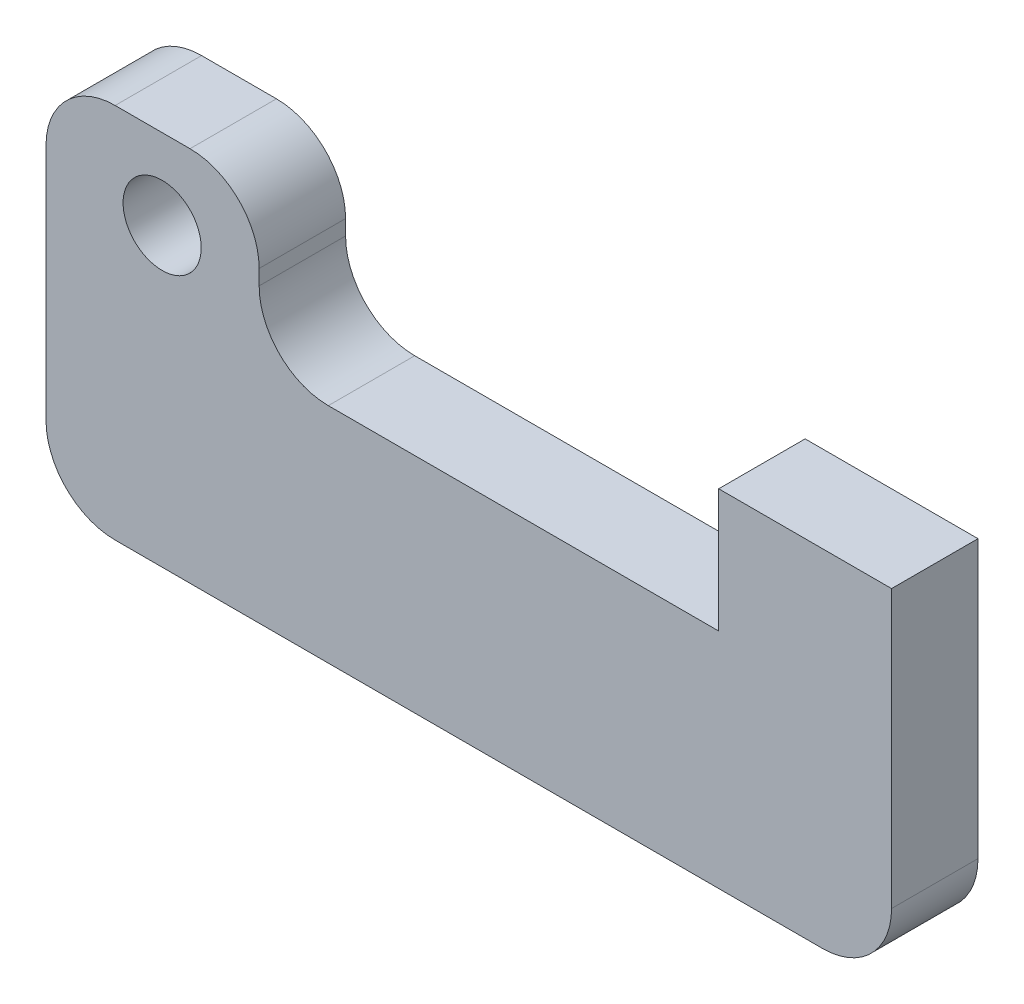
from build123d import *

# Parameters (mm, degrees)
SKETCH1_R           = 2.8702
BOSS_EXTRUDE1_DEPTH = 6.35
FILLET1_R           = 5.08


with BuildPart() as part:
    # Sketch1 → Boss-Extrude1 (new body)
    with BuildSketch(Plane.XY):
        Polygon((-133.35, 0), (-146.05, 0), (-146.05, -6.35), (-146.05, -9.05192086), (-179.812411975, -9.05192086), (-179.812411975, 2.216051439), (-195.472684717, 2.216051439), (-195.472684717, -16.678421964), (-195.472684717, -25.43652623), (-146.05, -25.43652623), (-133.35, -25.43652623), (-133.35, -6.35), align=None)
        with Locations((-186.939684717, -3.685756589)):
            Circle(SKETCH1_R, mode=Mode.SUBTRACT)
    extrude(amount=BOSS_EXTRUDE1_DEPTH)

    # Fillet1
    fillet1_edges = [part.edges().sort_by_distance(p)[0] for p in [
        (-133.35, -25.43652623, 3.175),
        (-195.472684717, -25.43652623, 3.175),
        (-195.472684717, 2.216051439, 3.175),
        (-179.812411975, 2.216051439, 3.175),
        (-179.812411975, -9.05192086, 3.175),
    ]]
    fillet(fillet1_edges, radius=FILLET1_R)


solid = part.part
